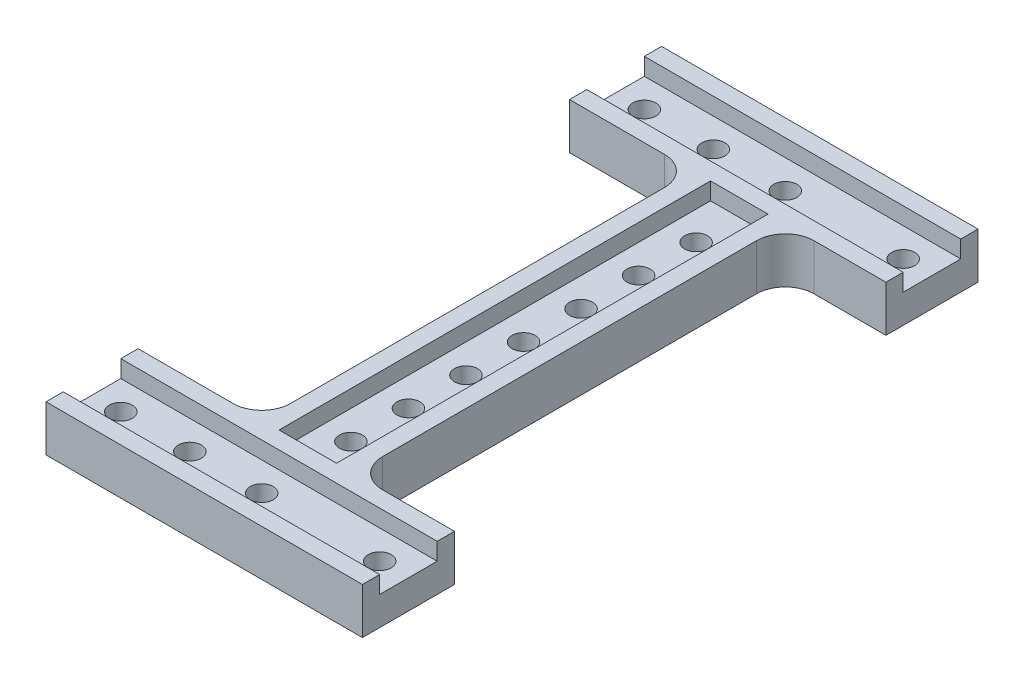
from build123d import *

# Parameters (mm, degrees)
SKETCH1_W           = 55
SKETCH1_H           = 16
SKETCH1_R           = 2
BOSS_EXTRUDE1_DEPTH = 5
SKETCH2_W           = 55
SKETCH2_H           = 3
BOSS_EXTRUDE2_DEPTH = 3
SKETCH4_W           = 55
SKETCH4_H           = 16
SKETCH4_R           = 2
BOSS_EXTRUDE3_DEPTH = 5
SKETCH5_W           = 55
SKETCH5_H           = 3
BOSS_EXTRUDE4_DEPTH = 3
BOSS_EXTRUDE5_DEPTH = 5
SKETCH7_W           = 3
SKETCH7_H           = 75
BOSS_EXTRUDE6_DEPTH = 3
SKETCH8_R           = 2
CUT_EXTRUDE2_DEPTH  = 5
SKETCH10_R          = 4
CUT_EXTRUDE3_DEPTH  = 2
SKETCH11_R          = 2
CUT_EXTRUDE4_DEPTH  = 5
SKETCH12_R          = 2
CUT_EXTRUDE5_DEPTH  = 5
FILLET1_R           = 5


with BuildPart() as part:
    # Sketch1 → Boss-Extrude1 (new body)
    with BuildSketch(Plane(origin=(0, 0, 0), x_dir=(1, 0, 0), z_dir=(0, 1, 0))):
        with Locations((-8.751560295, 3.021428571)):
            Rectangle(SKETCH1_W, SKETCH1_H)
        with Locations(Location((-6.751560295, 3.021428571, 0), (0, 0, 270))):
            Circle(SKETCH1_R, mode=Mode.SUBTRACT)
        with Locations(Location((-19.251560295, 3.021428571, 0), (0, 0, 270))):
            Circle(SKETCH1_R, mode=Mode.SUBTRACT)
    extrude(amount=BOSS_EXTRUDE1_DEPTH)

    # Sketch2 → Boss-Extrude2 (add)
    with BuildSketch(Plane(origin=(0, 5, 0), x_dir=(1, 0, 0), z_dir=(0, 1, 0))):
        with Locations((-8.751560295, 9.521428571)):
            Rectangle(SKETCH2_W, SKETCH2_H)
        with Locations((-8.751560295, -3.478571429)):
            Rectangle(SKETCH2_W, SKETCH2_H)
    extrude(amount=BOSS_EXTRUDE2_DEPTH)



with BuildPart() as body_2:
    # Sketch4 → Boss-Extrude3 (new body)
    with BuildSketch(Plane.XZ):
        with Locations((-8.751560295, 87.978571429)):
            Rectangle(SKETCH4_W, SKETCH4_H)
        with Locations(Location((-19.251560295, 87.978571429, 0), (0, 0, 270))):
            Circle(SKETCH4_R, mode=Mode.SUBTRACT)
        with Locations(Location((-6.751560295, 87.978571429, 0), (0, 0, 270))):
            Circle(SKETCH4_R, mode=Mode.SUBTRACT)
    extrude(amount=-BOSS_EXTRUDE3_DEPTH)

    # Sketch5 → Boss-Extrude4 (add)
    with BuildSketch(Plane(origin=(0, 5, 0), x_dir=(1, 0, 0), z_dir=(0, 1, 0))):
        with Locations((-8.751560295, -94.478571429)):
            Rectangle(SKETCH5_W, SKETCH5_H)
        with Locations((-8.751560295, -81.478571429)):
            Rectangle(SKETCH5_W, SKETCH5_H)
    extrude(amount=BOSS_EXTRUDE4_DEPTH)


with BuildPart() as part_1:
    add(part.part)

    add(body_2.part)  # Boss-Extrude5 merges body 2
    # Sketch6 → Boss-Extrude5 (add)
    with BuildSketch(Plane.XZ):
        Polygon((-6.751560295, 79.978571429), (1.248439705, 79.978571429), (1.248439705, 4.978571429), (-14.751560295, 4.978571429), (-14.751560295, 79.978571429), align=None)
    extrude(amount=-BOSS_EXTRUDE5_DEPTH)

    # Sketch7 → Boss-Extrude6 (add)
    with BuildSketch(Plane(origin=(0, 5, 0), x_dir=(1, 0, 0), z_dir=(0, 1, 0))):
        with Locations((-0.251560295, -42.478571429)):
            Rectangle(SKETCH7_W, SKETCH7_H)
        with Locations((-13.251560295, -42.478571429)):
            Rectangle(SKETCH7_W, SKETCH7_H)
    extrude(amount=BOSS_EXTRUDE6_DEPTH)

    # Sketch8 → Cut-Extrude2 (cut)
    with BuildSketch(Plane.XZ):
        with Locations(Location((13.748439705, -3.021428571, 0), (0, 0, 270))):
            Circle(SKETCH8_R)
        with Locations(Location((13.748439705, 87.978571429, 0), (0, 0, 270))):
            Circle(SKETCH8_R)
    extrude(amount=-CUT_EXTRUDE2_DEPTH, mode=Mode.SUBTRACT)

    # Sketch10 → Cut-Extrude3 (cut)
    with BuildSketch(Plane.XZ):
        with Locations(Location((-19.251560295, -3.021428571, 0), (0, 0, 270))):
            Circle(SKETCH10_R)
        with Locations(Location((-6.751560295, -3.021428571, 0), (0, 0, 270))):
            Circle(SKETCH10_R)
        with Locations(Location((13.748439705, -3.021428571, 0), (0, 0, 270))):
            Circle(SKETCH10_R)
        with Locations(Location((-19.251560295, 87.978571429, 0), (0, 0, 270))):
            Circle(SKETCH10_R)
        with Locations(Location((-6.751560295, 87.978571429, 0), (0, 0, 270))):
            Circle(SKETCH10_R)
        with Locations(Location((13.748439705, 87.978571429, 0), (0, 0, 270))):
            Circle(SKETCH10_R)
    extrude(amount=-CUT_EXTRUDE3_DEPTH, mode=Mode.SUBTRACT)

    # Sketch11 → Cut-Extrude4 (cut)
    with BuildSketch(Plane.XZ):
        with Locations(Location((-31.251560295, -3.021428571, 0), (0, 0, 270))):
            Circle(SKETCH11_R)
        with Locations(Location((-31.251560295, 87.978571429, 0), (0, 0, 270))):
            Circle(SKETCH11_R)
    extrude(amount=-CUT_EXTRUDE4_DEPTH, mode=Mode.SUBTRACT)

    # Sketch12 → Cut-Extrude5 (cut)
    with BuildSketch(Plane(origin=(0, 5, 0), x_dir=(1, 0, 0), z_dir=(0, 1, 0))):
        with Locations(Location((-6.751560295, -12.478571429, 0), (0, 0, 270))):
            Circle(SKETCH12_R)
        with Locations(Location((-6.751560295, -22.478571429, 0), (0, 0, 270))):
            Circle(SKETCH12_R)
        with Locations(Location((-6.751560295, -32.478571429, 0), (0, 0, 270))):
            Circle(SKETCH12_R)
        with Locations(Location((-6.751560295, -42.478571429, 0), (0, 0, 270))):
            Circle(SKETCH12_R)
        with Locations(Location((-6.751560295, -52.478571429, 0), (0, 0, 270))):
            Circle(SKETCH12_R)
        with Locations(Location((-6.751560295, -62.478571429, 0), (0, 0, 270))):
            Circle(SKETCH12_R)
        with Locations(Location((-6.751560295, -72.478571429, 0), (0, 0, 270))):
            Circle(SKETCH12_R)
    extrude(amount=-CUT_EXTRUDE5_DEPTH, mode=Mode.SUBTRACT)

    # Fillet1
    fillet1_edges = [part_1.edges().sort_by_distance(p)[0] for p in [
        (-14.751560295, 4, 79.978571429),
        (1.248439705, 4, 79.978571429),
        (1.248439705, 4, 4.978571429),
        (-14.751560295, 4, 4.978571429),
    ]]
    fillet(fillet1_edges, radius=FILLET1_R)


solid = part_1.part
